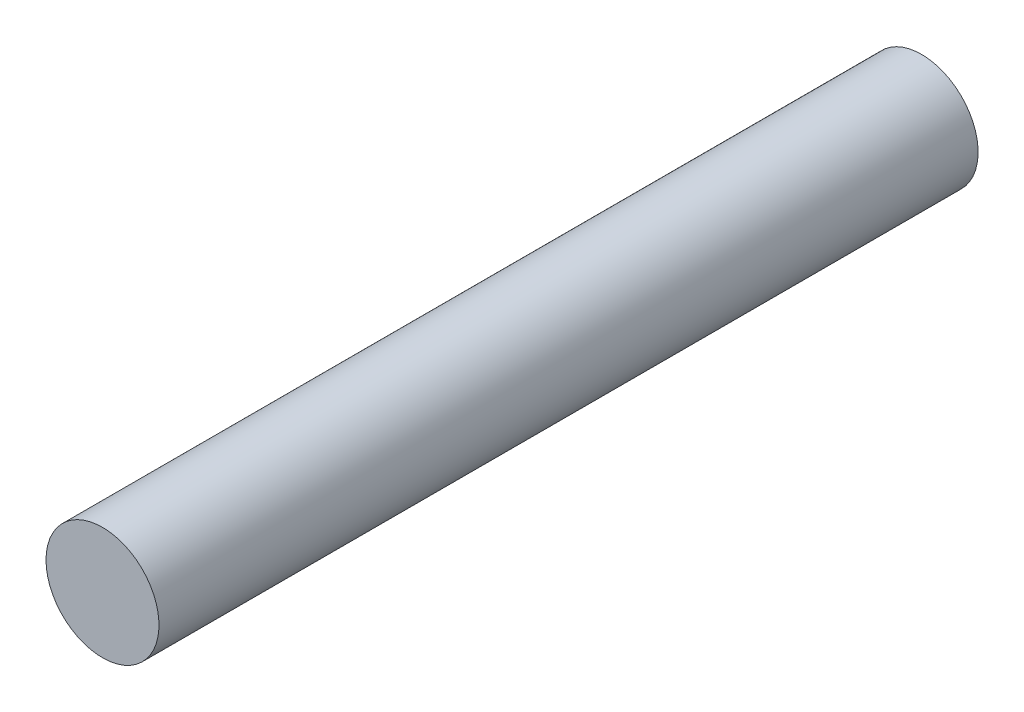
from build123d import *

# Parameters (mm, degrees)
SKETCH1_R           = 4
BOSS_EXTRUDE1_DEPTH = 58


with BuildPart() as part:
    # Sketch1 → Boss-Extrude1 (new body)
    with BuildSketch(Plane.XY):
        with Locations(Location((0, 0, 0), (0, 0, 180))):
            Circle(SKETCH1_R)
    extrude(amount=BOSS_EXTRUDE1_DEPTH)


solid = part.part
